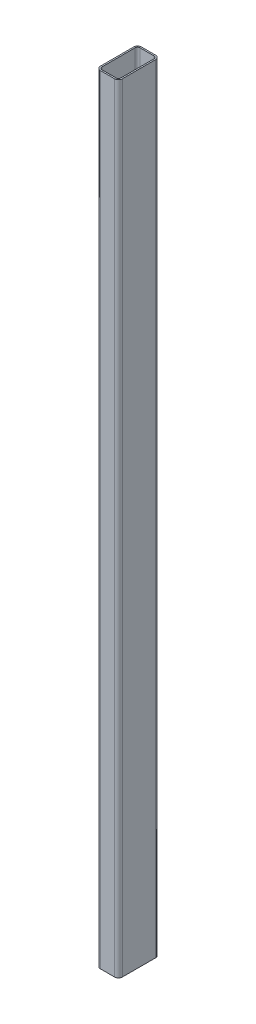
from build123d import *

# Parameters (mm, degrees)
EXTRUDE_THIN1_DEPTH = 1634
CUT_EXTRUDE1_REACH  = 1637.213
SKETCH7_R           = 5


with BuildPart() as part:
    # Sketch6 → Extrude-Thin1 (new body)
    with BuildSketch(Plane(origin=(0, 0, 0), x_dir=(1, 0, 0), z_dir=(0, 1, 0))):
        with BuildLine():
            Line((-23, 35), (-23, -35))
            ThreePointArc((-23, -35), (-20.656854249, -40.656854249), (-15, -43))
            Line((-15, -43), (15, -43))
            ThreePointArc((15, -43), (20.656854249, -40.656854249), (23, -35))
            Line((23, -35), (23, 35))
            ThreePointArc((23, 35), (20.656854249, 40.656854249), (15, 43))
            Line((15, 43), (-15, 43))
            ThreePointArc((-15, 43), (-20.656854249, 40.656854249), (-23, 35))
        make_face()
        with BuildLine():
            Line((-20, 35), (-20, -35))
            ThreePointArc((-20, -35), (-18.535533906, -38.535533906), (-15, -40))
            Line((-15, -40), (15, -40))
            ThreePointArc((15, -40), (18.535533906, -38.535533906), (20, -35))
            Line((20, -35), (20, 35))
            ThreePointArc((20, 35), (18.535533906, 38.535533906), (15, 40))
            Line((15, 40), (-15, 40))
            ThreePointArc((-15, 40), (-18.535533906, 38.535533906), (-20, 35))
        make_face(mode=Mode.SUBTRACT)
    extrude(amount=EXTRUDE_THIN1_DEPTH)

    # Sketch7 → Cut-Extrude1 (cut, up to next)
    with BuildSketch(Plane.ZY.offset(23), mode=Mode.PRIVATE) as cut_extrude1_sk1:
        with Locations((0, 35)):
            Circle(SKETCH7_R)
    cut_extrude1_tool1 = extrude(cut_extrude1_sk1.sketch, amount=-CUT_EXTRUDE1_REACH, mode=Mode.PRIVATE) & part.part
    # Sketch7 → Cut-Extrude1 (cut, up to next)
    with BuildSketch(Plane.ZY.offset(23), mode=Mode.PRIVATE) as cut_extrude1_sk2:
        with Locations((0, 75)):
            Circle(SKETCH7_R)
    cut_extrude1_tool2 = extrude(cut_extrude1_sk2.sketch, amount=-CUT_EXTRUDE1_REACH, mode=Mode.PRIVATE) & part.part
    add(cut_extrude1_tool1.solids().sort_by_distance((-23, 35, 0))[0], mode=Mode.SUBTRACT)
    add(cut_extrude1_tool2.solids().sort_by_distance((-23, 75, 0))[0], mode=Mode.SUBTRACT)


solid = part.part
